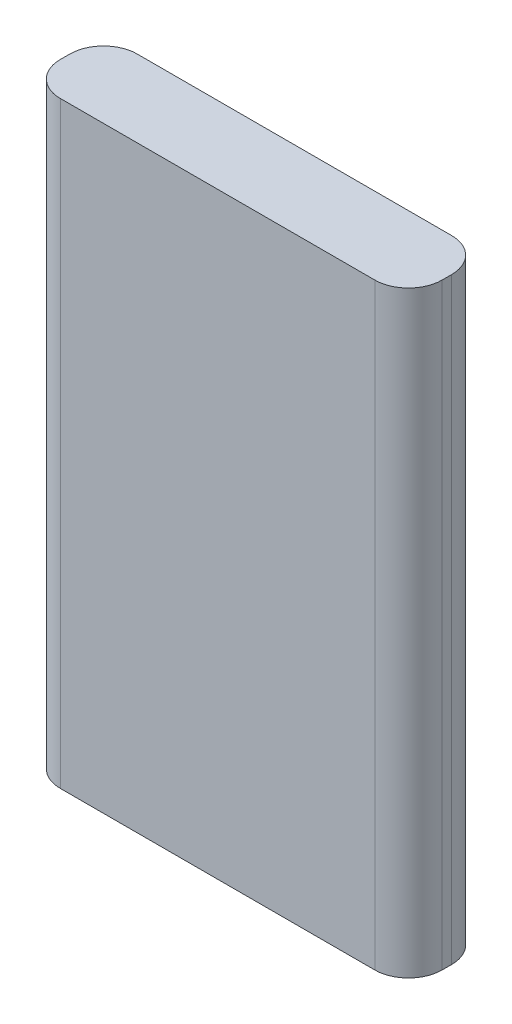
from build123d import *

# Parameters (mm, degrees)
EXTRUDE_1_DEPTH = 53.2


with BuildPart() as part:
    # Эскиз1 → Бобышка-Вытянуть1 (new body)
    with BuildSketch(Plane(origin=(0, 0, 0), x_dir=(1, 0, 0), z_dir=(0, 1, 0))):
        with BuildLine():
            Line((-14, 3.425), (14, 3.425))
            ThreePointArc((14, 3.425), (16.121320344, 2.546320344), (17, 0.425))
            Line((17, 0.425), (17, -0.425))
            ThreePointArc((17, -0.425), (16.121320344, -2.546320344), (14, -3.425))
            Line((14, -3.425), (-14, -3.425))
            ThreePointArc((-14, -3.425), (-16.121320344, -2.546320344), (-17, -0.425))
            Line((-17, -0.425), (-17, 0.425))
            ThreePointArc((-17, 0.425), (-16.121320344, 2.546320344), (-14, 3.425))
        make_face()
    extrude(amount=EXTRUDE_1_DEPTH)


solid = part.part
